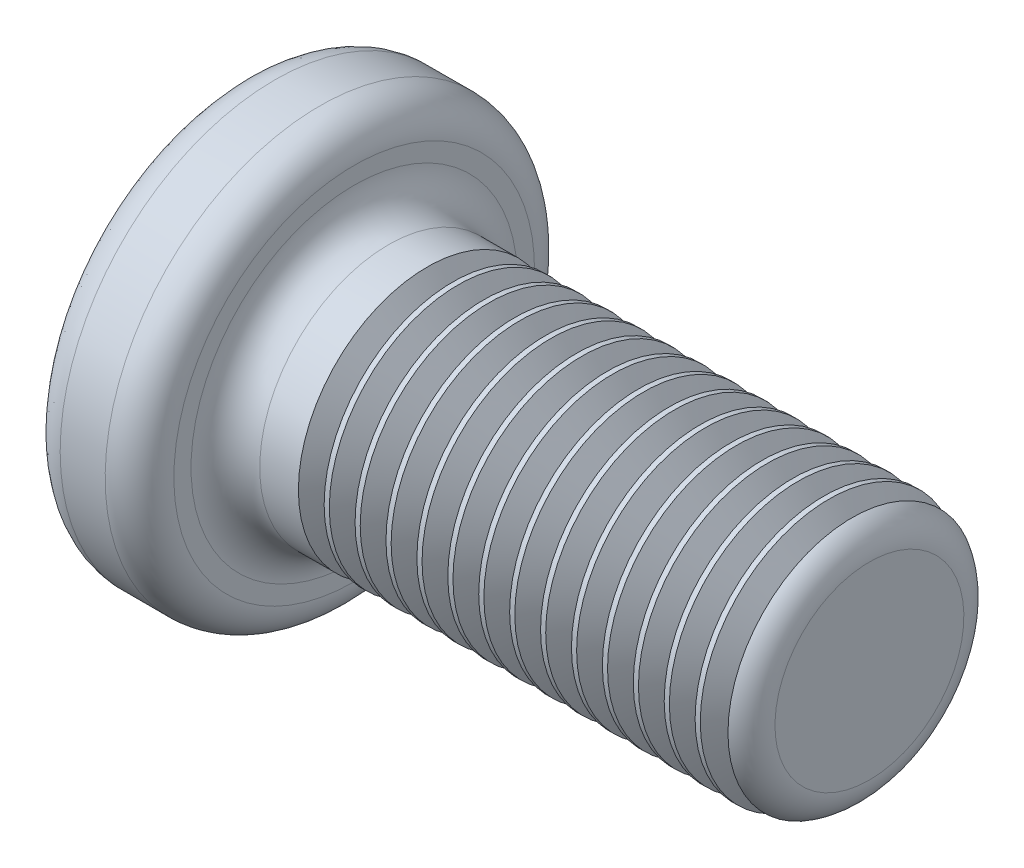
from build123d import *

# Parameters (mm, degrees)
CUT_EXTRUDE1_DEPTH = 1.2
FILLET1_R          = 0.4
DRAFT1_ANGLE       = -30
LPATTERN10_COUNT   = 14
LPATTERN10_PITCH   = 0.36


with BuildPart() as part:
    # Sketch1 → Base (revolve)
    with BuildSketch(Plane.XY, mode=Mode.PRIVATE) as base_sk:
        with BuildLine():
            Line((8, 0), (8, 1.5))
            Line((8, 1.5), (2, 1.5))
            Line((2, 1.5), (2, 2.5))
            Line((2, 2.5), (0.877501001, 2.5))
            ThreePointArc((0.877501001, 2.5), (0.225745372, 1.324764885), (0, 0))
            Line((0, 0), (8, 0))
        make_face()
    revolve(base_sk.sketch.rotate(Axis((-8.635649275, 0, 0), (1, 0, 0)), 180), axis=Axis((-8.635649275, 0, 0), (1, 0, 0)))

    # Sketch2 → Cut-Extrude1 (cut)
    with BuildSketch(Plane(origin=(0, 0, 0), x_dir=(0, 0, -1), z_dir=(1, 0, 0))):
        Polygon((-0.3, 1.5), (0.3, 1.5), (0.3, 0.3), (1.5, 0.3), (1.5, -0.3), (0.3, -0.3), (0.3, -1.5), (-0.3, -1.5), (-0.3, -0.3), (-1.5, -0.3), (-1.5, 0.3), (-0.3, 0.3), align=None)
    extrude(amount=CUT_EXTRUDE1_DEPTH, mode=Mode.SUBTRACT)

    # Fillet1
    fillet1_edges = [part.edges().sort_by_distance(p)[0] for p in [
        (0.877501001, 2.5, 0),
        (2, 2.5, 0),
        (2, 1.5, 0),
        (8, 1.5, 0),
    ]]
    fillet(fillet1_edges, radius=FILLET1_R)

    # Draft1
    draft1_faces = [part.faces().sort_by_distance(p)[0] for p in [
        (0.747967708, 1.5, 0),
        (0.747967708, 0, 1.5),
        (0.747967708, -1.5, 0),
        (0.747967708, 0, -1.5),
    ]]
    draft(draft1_faces, Plane(origin=(0, 0, 0), x_dir=(0, 0, 1), z_dir=(1, 0, 0)), DRAFT1_ANGLE)

    # Sketch3 → Cut-Revolve10 (revolve, cut)
    with BuildSketch(Plane.XY, mode=Mode.PRIVATE) as cut_revolve10_sk:
        Polygon((2.85, 1.8), (3.15, 1.8), (3.15, 1.5), (3, 1.240192379), (2.85, 1.5), align=None)
    cut_revolve10 = revolve(cut_revolve10_sk.sketch.rotate(Axis((0, 0, 0), (1, 0, 0)), 90), axis=Axis((0, 0, 0), (1, 0, 0)), mode=Mode.SUBTRACT)

    # LPattern10: Cut-Revolve10 ×14
    with Locations(*[(i * LPATTERN10_PITCH, 0, 0) for i in range(1, LPATTERN10_COUNT)]):
        add(cut_revolve10, mode=Mode.SUBTRACT)


solid = part.part
